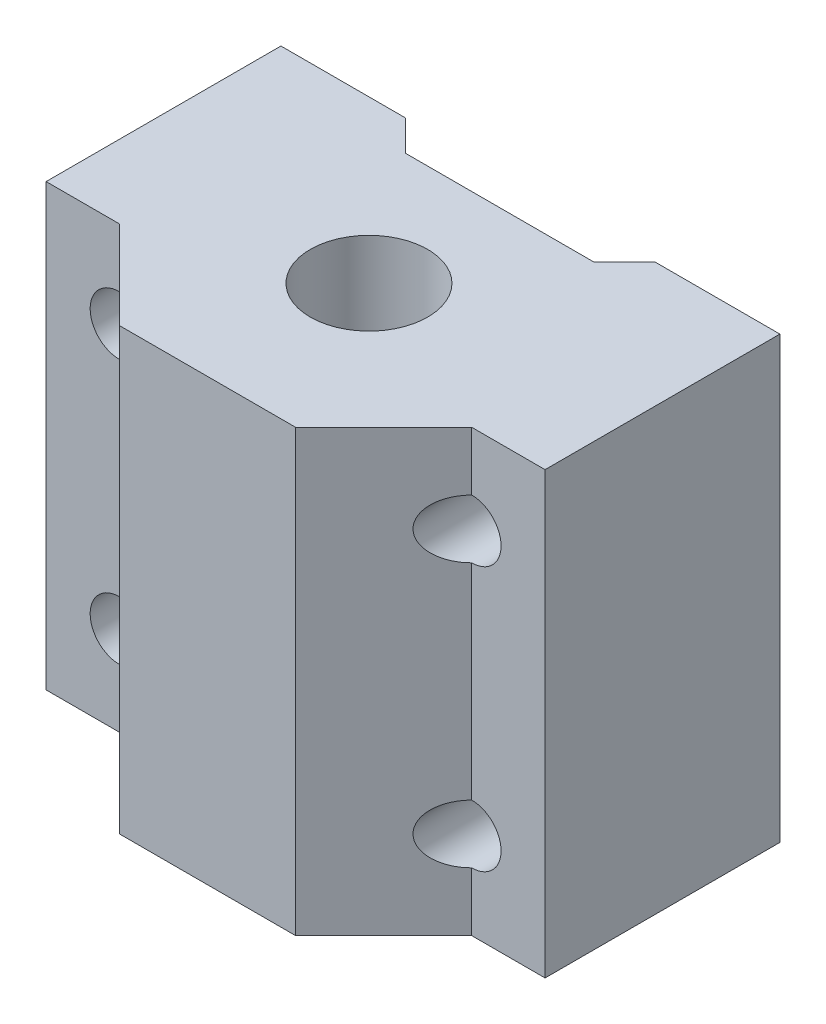
from build123d import *

# Parameters (mm, degrees)
SKETCH1_W           = 34
SKETCH1_H           = 30
SKETCH1_R           = 2
BOSS_EXTRUDE1_DEPTH = 22
SKETCH3_R           = 4
CUT_EXTRUDE1_DEPTH  = 30


with BuildPart() as part:
    # Sketch1 → Boss-Extrude1 (new body)
    with BuildSketch(Plane.XY):
        Rectangle(SKETCH1_W, SKETCH1_H)
        with Locations((-12, 9)):
            Circle(SKETCH1_R, mode=Mode.SUBTRACT)
        with Locations((-12, -9)):
            Circle(SKETCH1_R, mode=Mode.SUBTRACT)
        with Locations((12, 9)):
            Circle(SKETCH1_R, mode=Mode.SUBTRACT)
        with Locations((12, -9)):
            Circle(SKETCH1_R, mode=Mode.SUBTRACT)
    extrude(amount=BOSS_EXTRUDE1_DEPTH)

    # Sketch3 → Cut-Extrude1 (cut)
    with BuildSketch(Plane(origin=(0, 15, 0), x_dir=(1, 0, 0), z_dir=(0, 1, 0))):
        with Locations(Location((0, -11, 0), (0, 0, 270))):
            Circle(SKETCH3_R)
        Polygon((-17, -16), (-12, -16), (-6, -22), (-17, -22), align=None)
        Polygon((17, -22), (6, -22), (12, -16), (17, -16), align=None)
        Polygon((-8.5, 0), (-6.414897811, -2.085102189), (6.414897811, -2.085102189), (8.5, 0), align=None)
    extrude(amount=-CUT_EXTRUDE1_DEPTH, mode=Mode.SUBTRACT)


solid = part.part
